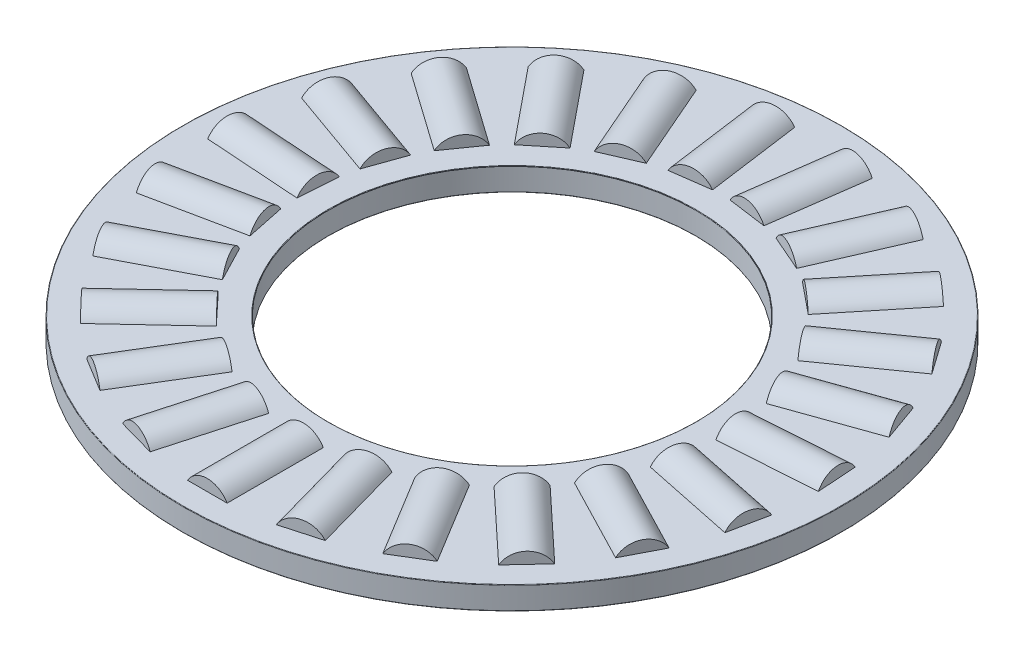
from build123d import *

# Parameters (mm, degrees)
SKETCH1_W         = 6.3246
SKETCH1_H         = 0.9921875
SKETCH3_W         = 4.1671875
SKETCH3_H         = 0.9921875
SKETCH2_W         = 4.1671875
SKETCH2_H         = 0.9921875
CIRPATTERN1_COUNT = 23
CIRPATTERN1_ANGLE = 344.347826087
CIRPATTERN2_COUNT = 23
FILLET2_R         = 0.01984375


with BuildPart() as part:
    # Sketch1 → Revolve1 (revolve)
    with BuildSketch(Plane(origin=(0, 0, 0), x_dir=(0, 0, -1), z_dir=(1, 0, 0)), mode=Mode.PRIVATE) as revolve1_sk:
        with Locations((-11.1252, 0)):
            Rectangle(SKETCH1_W, SKETCH1_H)
    revolve(revolve1_sk.sketch.rotate(Axis((0, -0.9921875, 0), (0, 1, 0)), 180), axis=Axis((0, -0.9921875, 0), (0, 1, 0)))

    # Sketch3 → Cut-Revolve1 (revolve, cut)
    with BuildSketch(Plane(origin=(0, 0, 0), x_dir=(0, 0, -1), z_dir=(1, 0, 0))):
        with Locations((-11.1252, 0.49609375)):
            Rectangle(SKETCH3_W, SKETCH3_H)
    cut_revolve1 = revolve(axis=Axis((0, 0, 13.20879375), (0, 0, -1)), mode=Mode.SUBTRACT)

    # CirPattern2: Cut-Revolve1 ×23 about axis
    cirpattern2_axis = Axis((0, 0, 0), (0, 1, 0))
    for i in range(1, CIRPATTERN2_COUNT):
        add(cut_revolve1.rotate(cirpattern2_axis, i * 360 / CIRPATTERN2_COUNT), mode=Mode.SUBTRACT)

    # Fillet2
    fillet2_edges = [part.edges().sort_by_distance(p)[0] for p in [
        (0, 0.49609375, 14.2875),
        (0, 0.49609375, 7.9629),
        (0, -0.49609375, 7.9629),
        (0, -0.49609375, 14.2875),
    ]]
    fillet(fillet2_edges, radius=FILLET2_R)


with BuildPart() as body_2:
    # Sketch2 → Revolve2 (revolve)
    with BuildSketch(Plane(origin=(0, 0, 0), x_dir=(0, 0, -1), z_dir=(1, 0, 0)), mode=Mode.PRIVATE) as revolve2_sk:
        with Locations((-11.1252, 0.49609375)):
            Rectangle(SKETCH2_W, SKETCH2_H)
    revolve(revolve2_sk.sketch.rotate(Axis((0, 0, 13.20879375), (0, 0, -1)), 90), axis=Axis((0, 0, 13.20879375), (0, 0, -1)))


with BuildPart() as cirpattern1_1:
    # CirPattern1: pattern copy
    add(body_2.part.rotate(Axis((0, 0.9921875, 0), (0, -1, 0)), 1 * CIRPATTERN1_ANGLE / (CIRPATTERN1_COUNT - 1)))


with BuildPart() as cirpattern1_2:
    # CirPattern1: pattern copy
    add(body_2.part.rotate(Axis((0, 0.9921875, 0), (0, -1, 0)), 2 * CIRPATTERN1_ANGLE / (CIRPATTERN1_COUNT - 1)))


with BuildPart() as cirpattern1_3:
    # CirPattern1: pattern copy
    add(body_2.part.rotate(Axis((0, 0.9921875, 0), (0, -1, 0)), 3 * CIRPATTERN1_ANGLE / (CIRPATTERN1_COUNT - 1)))


with BuildPart() as cirpattern1_4:
    # CirPattern1: pattern copy
    add(body_2.part.rotate(Axis((0, 0.9921875, 0), (0, -1, 0)), 4 * CIRPATTERN1_ANGLE / (CIRPATTERN1_COUNT - 1)))


with BuildPart() as cirpattern1_5:
    # CirPattern1: pattern copy
    add(body_2.part.rotate(Axis((0, 0.9921875, 0), (0, -1, 0)), 5 * CIRPATTERN1_ANGLE / (CIRPATTERN1_COUNT - 1)))


with BuildPart() as cirpattern1_6:
    # CirPattern1: pattern copy
    add(body_2.part.rotate(Axis((0, 0.9921875, 0), (0, -1, 0)), 6 * CIRPATTERN1_ANGLE / (CIRPATTERN1_COUNT - 1)))


with BuildPart() as cirpattern1_7:
    # CirPattern1: pattern copy
    add(body_2.part.rotate(Axis((0, 0.9921875, 0), (0, -1, 0)), 7 * CIRPATTERN1_ANGLE / (CIRPATTERN1_COUNT - 1)))


with BuildPart() as cirpattern1_8:
    # CirPattern1: pattern copy
    add(body_2.part.rotate(Axis((0, 0.9921875, 0), (0, -1, 0)), 8 * CIRPATTERN1_ANGLE / (CIRPATTERN1_COUNT - 1)))


with BuildPart() as cirpattern1_9:
    # CirPattern1: pattern copy
    add(body_2.part.rotate(Axis((0, 0.9921875, 0), (0, -1, 0)), 9 * CIRPATTERN1_ANGLE / (CIRPATTERN1_COUNT - 1)))


with BuildPart() as cirpattern1_10:
    # CirPattern1: pattern copy
    add(body_2.part.rotate(Axis((0, 0.9921875, 0), (0, -1, 0)), 10 * CIRPATTERN1_ANGLE / (CIRPATTERN1_COUNT - 1)))


with BuildPart() as cirpattern1_11:
    # CirPattern1: pattern copy
    add(body_2.part.rotate(Axis((0, 0.9921875, 0), (0, -1, 0)), 11 * CIRPATTERN1_ANGLE / (CIRPATTERN1_COUNT - 1)))


with BuildPart() as cirpattern1_12:
    # CirPattern1: pattern copy
    add(body_2.part.rotate(Axis((0, 0.9921875, 0), (0, -1, 0)), 12 * CIRPATTERN1_ANGLE / (CIRPATTERN1_COUNT - 1)))


with BuildPart() as cirpattern1_13:
    # CirPattern1: pattern copy
    add(body_2.part.rotate(Axis((0, 0.9921875, 0), (0, -1, 0)), 13 * CIRPATTERN1_ANGLE / (CIRPATTERN1_COUNT - 1)))


with BuildPart() as cirpattern1_14:
    # CirPattern1: pattern copy
    add(body_2.part.rotate(Axis((0, 0.9921875, 0), (0, -1, 0)), 14 * CIRPATTERN1_ANGLE / (CIRPATTERN1_COUNT - 1)))


with BuildPart() as cirpattern1_15:
    # CirPattern1: pattern copy
    add(body_2.part.rotate(Axis((0, 0.9921875, 0), (0, -1, 0)), 15 * CIRPATTERN1_ANGLE / (CIRPATTERN1_COUNT - 1)))


with BuildPart() as cirpattern1_16:
    # CirPattern1: pattern copy
    add(body_2.part.rotate(Axis((0, 0.9921875, 0), (0, -1, 0)), 16 * CIRPATTERN1_ANGLE / (CIRPATTERN1_COUNT - 1)))


with BuildPart() as cirpattern1_17:
    # CirPattern1: pattern copy
    add(body_2.part.rotate(Axis((0, 0.9921875, 0), (0, -1, 0)), 17 * CIRPATTERN1_ANGLE / (CIRPATTERN1_COUNT - 1)))


with BuildPart() as cirpattern1_18:
    # CirPattern1: pattern copy
    add(body_2.part.rotate(Axis((0, 0.9921875, 0), (0, -1, 0)), 18 * CIRPATTERN1_ANGLE / (CIRPATTERN1_COUNT - 1)))


with BuildPart() as cirpattern1_19:
    # CirPattern1: pattern copy
    add(body_2.part.rotate(Axis((0, 0.9921875, 0), (0, -1, 0)), 19 * CIRPATTERN1_ANGLE / (CIRPATTERN1_COUNT - 1)))


with BuildPart() as cirpattern1_20:
    # CirPattern1: pattern copy
    add(body_2.part.rotate(Axis((0, 0.9921875, 0), (0, -1, 0)), 20 * CIRPATTERN1_ANGLE / (CIRPATTERN1_COUNT - 1)))


with BuildPart() as cirpattern1_21:
    # CirPattern1: pattern copy
    add(body_2.part.rotate(Axis((0, 0.9921875, 0), (0, -1, 0)), 21 * CIRPATTERN1_ANGLE / (CIRPATTERN1_COUNT - 1)))


with BuildPart() as cirpattern1_22:
    # CirPattern1: pattern copy
    add(body_2.part.rotate(Axis((0, 0.9921875, 0), (0, -1, 0)), 22 * CIRPATTERN1_ANGLE / (CIRPATTERN1_COUNT - 1)))


solid = Compound([part.part, body_2.part, cirpattern1_1.part, cirpattern1_2.part, cirpattern1_3.part, cirpattern1_4.part, cirpattern1_5.part, cirpattern1_6.part, cirpattern1_7.part, cirpattern1_8.part, cirpattern1_9.part, cirpattern1_10.part, cirpattern1_11.part, cirpattern1_12.part, cirpattern1_13.part, cirpattern1_14.part, cirpattern1_15.part, cirpattern1_16.part, cirpattern1_17.part, cirpattern1_18.part, cirpattern1_19.part, cirpattern1_20.part, cirpattern1_21.part, cirpattern1_22.part])
